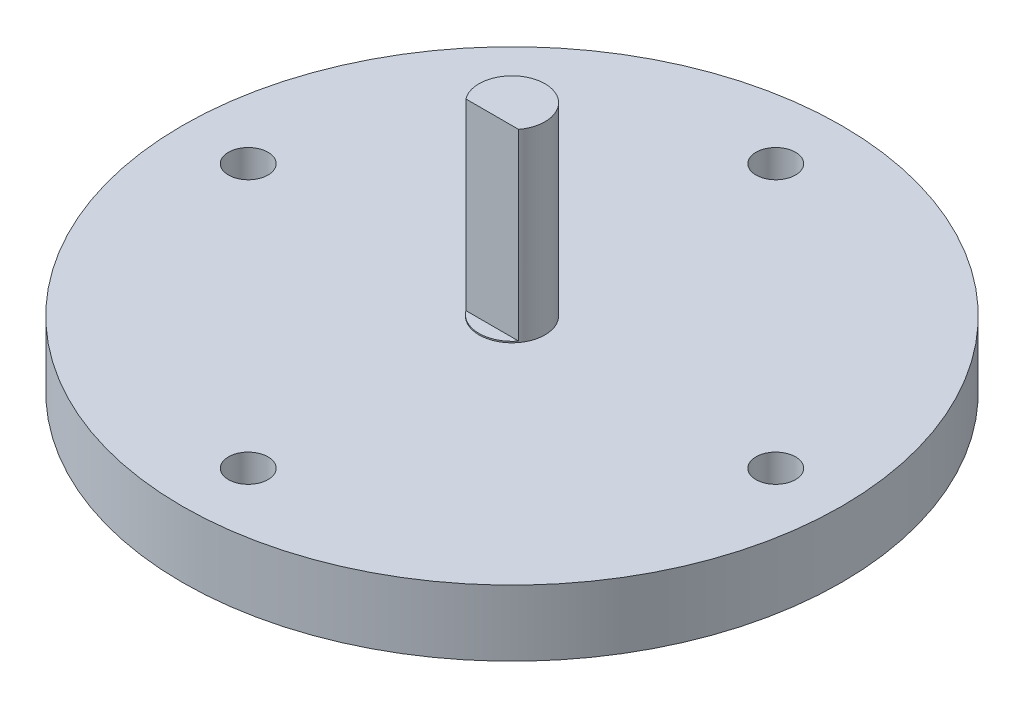
from build123d import *

# Parameters (mm, degrees)
SKETCH1_R           = 25
SKETCH1_R_2         = 1.5
BOSS_EXTRUDE1_DEPTH = 5
SKETCH2_R           = 2.5
BOSS_EXTRUDE2_DEPTH = 14
SKETCH3_R           = 1.5
CUT_EXTRUDE1_DEPTH  = 5
CUT_EXTRUDE3_START  = -13.9
CUT_EXTRUDE3_DEPTH  = 13.9


with BuildPart() as part:
    # Sketch1 → Boss-Extrude1 (new body)
    with BuildSketch(Plane(origin=(0, 0, 0), x_dir=(1, 0, 0), z_dir=(0, 1, 0))):
        with Locations(Location((0, 0, 0), (0, 0, 270))):
            Circle(SKETCH1_R)
        with Locations(Location((0, -20, 0), (0, 0, 270))):
            Circle(SKETCH1_R_2, mode=Mode.SUBTRACT)
        with Locations(Location((-20, 0, 0), (0, 0, 270))):
            Circle(SKETCH1_R_2, mode=Mode.SUBTRACT)
        with Locations(Location((0, 20, 0), (0, 0, 270))):
            Circle(SKETCH1_R_2, mode=Mode.SUBTRACT)
        with Locations(Location((20, 0, 0), (0, 0, 270))):
            Circle(SKETCH1_R_2, mode=Mode.SUBTRACT)
    extrude(amount=BOSS_EXTRUDE1_DEPTH)

    # Sketch2 → Boss-Extrude2 (add)
    with BuildSketch(Plane(origin=(0, 5, 0), x_dir=(1, 0, 0), z_dir=(0, 1, 0))):
        with Locations(Location((0, 0, 0), (0, 0, 270))):
            Circle(SKETCH2_R)
    extrude(amount=BOSS_EXTRUDE2_DEPTH)

    # Sketch3 → Cut-Extrude1 (cut)
    with BuildSketch(Plane.XZ):
        with Locations(Location((0, 0, 0), (0, 0, 270))):
            Circle(SKETCH3_R)
    extrude(amount=-CUT_EXTRUDE1_DEPTH, mode=Mode.SUBTRACT)

    # Sketch4 → Cut-Extrude3 (cut)
    with BuildSketch(Plane(origin=(0, 19, 0), x_dir=(1, 0, 0), z_dir=(0, 1, 0)).offset(CUT_EXTRUDE3_START)):
        with BuildLine():
            Line((2, -1.5), (-2, -1.5))
            ThreePointArc((-2, -1.5), (0, -2.5), (2, -1.5))
        make_face()
    extrude(amount=CUT_EXTRUDE3_DEPTH, mode=Mode.SUBTRACT)


solid = part.part
